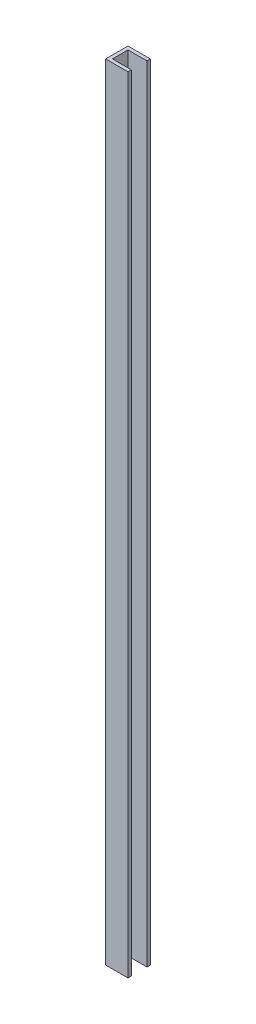
from build123d import *

# Parameters (mm, degrees)
BOSS_EXTRUDE1_DEPTH = 176


with BuildPart() as part:
    # Sketch2 → Boss-Extrude1 (new, symmetric)
    with BuildSketch(Plane(origin=(0, 0, 0), x_dir=(1, 0, 0), z_dir=(0, 1, 0))):
        Polygon((-5, 5), (-5, -5), (5, -5), (5, -3.5), (-3.5, -3.5), (-3.5, 3.5), (5, 3.5), (5, 5), align=None)
    extrude(amount=BOSS_EXTRUDE1_DEPTH, both=True)


solid = part.part
